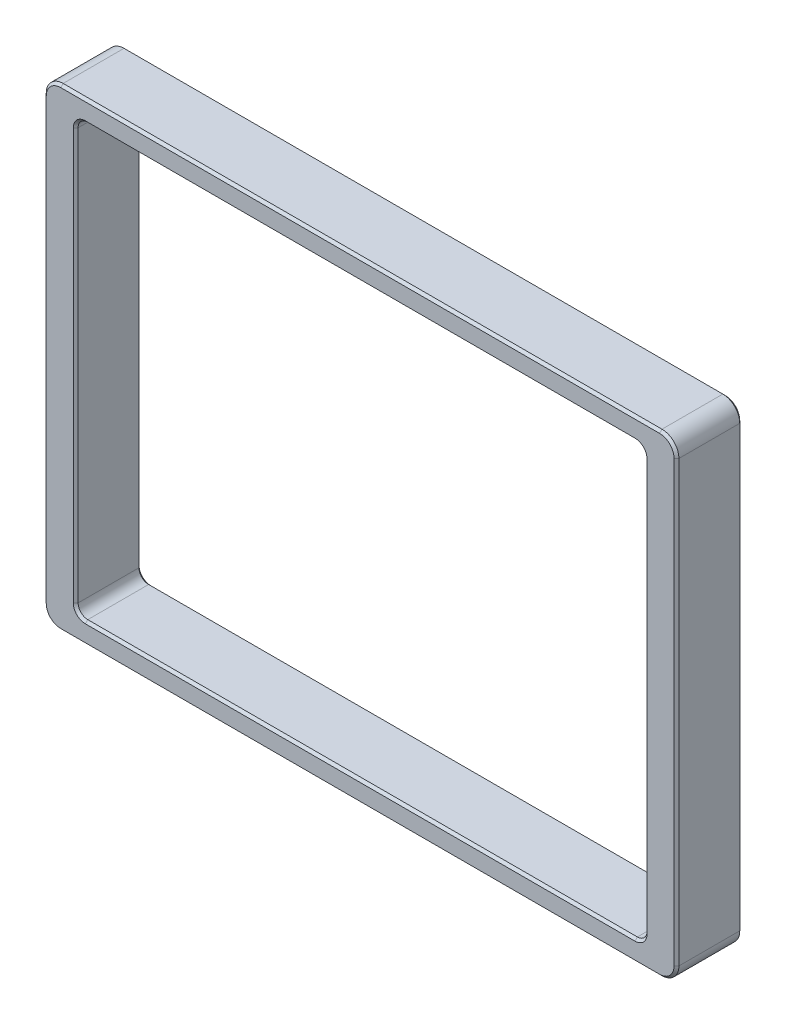
from build123d import *

# Parameters (mm, degrees)
BOSS_EXTRUDE1_DEPTH = 13.6
DEBURS_SIZE         = 0.5


with BuildPart() as part:
    # Sketch1 → Boss-Extrude1 (new body)
    with BuildSketch(Plane.XY):
        with BuildLine():
            Line((-65.5, 45.5), (-65.5, -45.5))
            ThreePointArc((-65.5, -45.5), (-64.474873734, -47.974873734), (-62, -49))
            Line((-62, -49), (62, -49))
            ThreePointArc((62, -49), (64.474873734, -47.974873734), (65.5, -45.5))
            Line((65.5, -45.5), (65.5, 45.5))
            ThreePointArc((65.5, 45.5), (64.474873734, 47.974873734), (62, 49))
            Line((62, 49), (-62, 49))
            ThreePointArc((-62, 49), (-64.474873734, 47.974873734), (-65.5, 45.5))
        make_face()
        with BuildLine():
            Line((-56.9, 44.6), (56.9, 44.6))
            ThreePointArc((56.9, 44.6), (58.314213562, 44.014213562), (58.9, 42.6))
            Line((58.9, 42.6), (58.9, -42.6))
            ThreePointArc((58.9, -42.6), (58.314213562, -44.014213562), (56.9, -44.6))
            Line((56.9, -44.6), (-56.9, -44.6))
            ThreePointArc((-56.9, -44.6), (-58.314213562, -44.014213562), (-58.9, -42.6))
            Line((-58.9, -42.6), (-58.9, 42.6))
            ThreePointArc((-58.9, 42.6), (-58.314213562, 44.014213562), (-56.9, 44.6))
        make_face(mode=Mode.SUBTRACT)
    extrude(amount=BOSS_EXTRUDE1_DEPTH)

    # Deburs
    deburs_edges = [part.edges().sort_by_distance(p)[0] for p in [
        (58.314213562, 44.014213562, 0),
        (0, 44.6, 0),
        (-58.314213562, 44.014213562, 0),
        (-58.9, 0, 0),
        (-58.314213562, -44.014213562, 0),
        (0, -44.6, 0),
        (-64.474873734, 47.974873734, 13.6),
        (-64.474873734, 47.974873734, 0),
        (-65.5, 0, 13.6),
        (-65.5, 0, 0),
        (-64.474873734, -47.974873734, 13.6),
        (-64.474873734, -47.974873734, 0),
        (0, -49, 13.6),
        (0, -49, 0),
        (64.474873734, -47.974873734, 13.6),
        (64.474873734, -47.974873734, 0),
        (65.5, 0, 13.6),
        (65.5, 0, 0),
        (58.314213562, -44.014213562, 0),
        (64.474873734, 47.974873734, 13.6),
        (64.474873734, 47.974873734, 0),
        (0, 49, 13.6),
        (0, 49, 0),
        (58.314213562, -44.014213562, 13.6),
        (0, -44.6, 13.6),
        (-58.314213562, -44.014213562, 13.6),
        (-58.9, 0, 13.6),
        (-58.314213562, 44.014213562, 13.6),
        (0, 44.6, 13.6),
        (58.314213562, 44.014213562, 13.6),
        (58.9, 0, 13.6),
        (58.9, 0, 0),
    ]]
    chamfer(deburs_edges, length=DEBURS_SIZE)


solid = part.part
